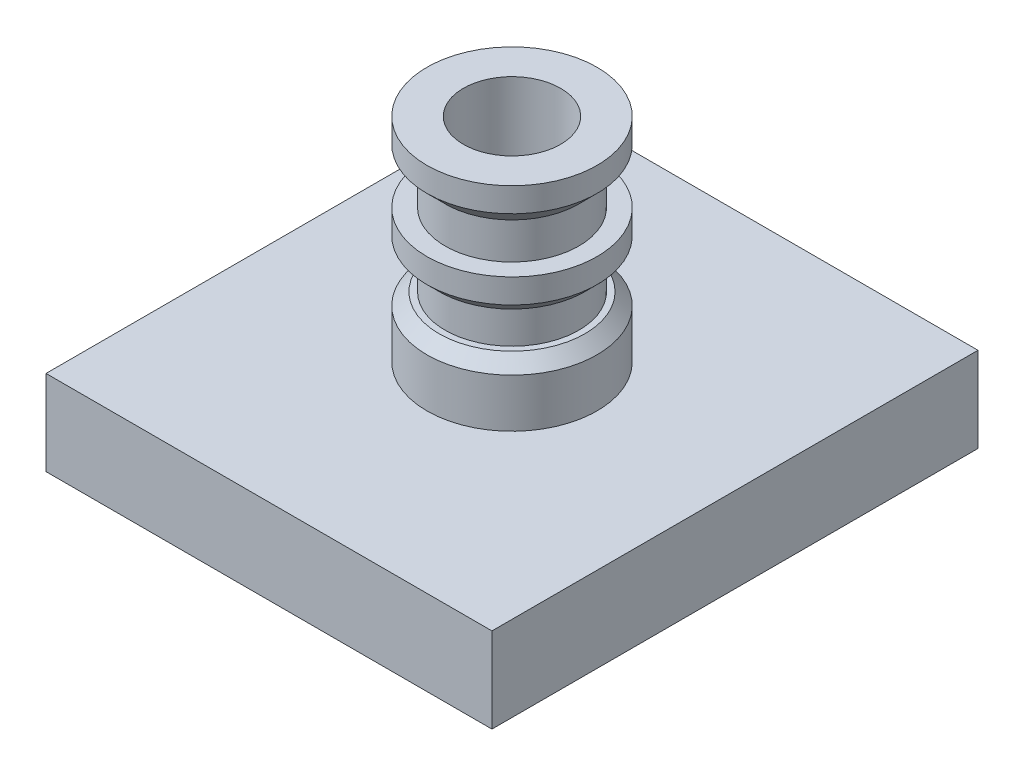
from build123d import *

# Parameters (mm, degrees)
CROQUIS1_W              = 36.7
CROQUIS1_H              = 40
CROQUIS1_R              = 4
SALIENTE_EXTRUIR1_DEPTH = 7
CHAFL_N1_SIZE           = 1
CROQUIS3_R              = 6.55
CORTAR_EXTRUIR1_DEPTH   = 2


with BuildPart() as part:
    # Croquis1 → Saliente-Extruir1 (new body)
    with BuildSketch(Plane(origin=(0, 0, 0), x_dir=(1, 0, 0), z_dir=(0, 1, 0))):
        Rectangle(CROQUIS1_W, CROQUIS1_H)
        with Locations(Location((0, 0, 0), (0, 0, 270))):
            Circle(CROQUIS1_R, mode=Mode.SUBTRACT)
    extrude(amount=SALIENTE_EXTRUIR1_DEPTH)

    # Croquis2 → Revolución1 (revolve)
    with BuildSketch(Plane(origin=(0, 0, 0), x_dir=(0, 0, -1), z_dir=(1, 0, 0))):
        Polygon((7, 7), (7, 12), (5.5, 12), (5.5, 15), (7, 15), (7, 18), (5.5, 18), (5.5, 21), (7, 22.5), (7, 24.5), (4, 24.5), (4, 7), align=None)
    revolve(axis=Axis((0, 7, 0), (0, 1, 0)))

    # Chaflán1
    chafl_n1_edges = [part.edges().sort_by_distance(p)[0] for p in [
        (0, 12, 7),
        (0, 15, 7),
    ]]
    chamfer(chafl_n1_edges, length=CHAFL_N1_SIZE)

    # Croquis3 → Cortar-Extruir1 (cut)
    with BuildSketch(Plane.XZ):
        with Locations(Location((0, 0, 0), (0, 0, 270))):
            Circle(CROQUIS3_R)
    extrude(amount=-CORTAR_EXTRUIR1_DEPTH, mode=Mode.SUBTRACT)


solid = part.part
